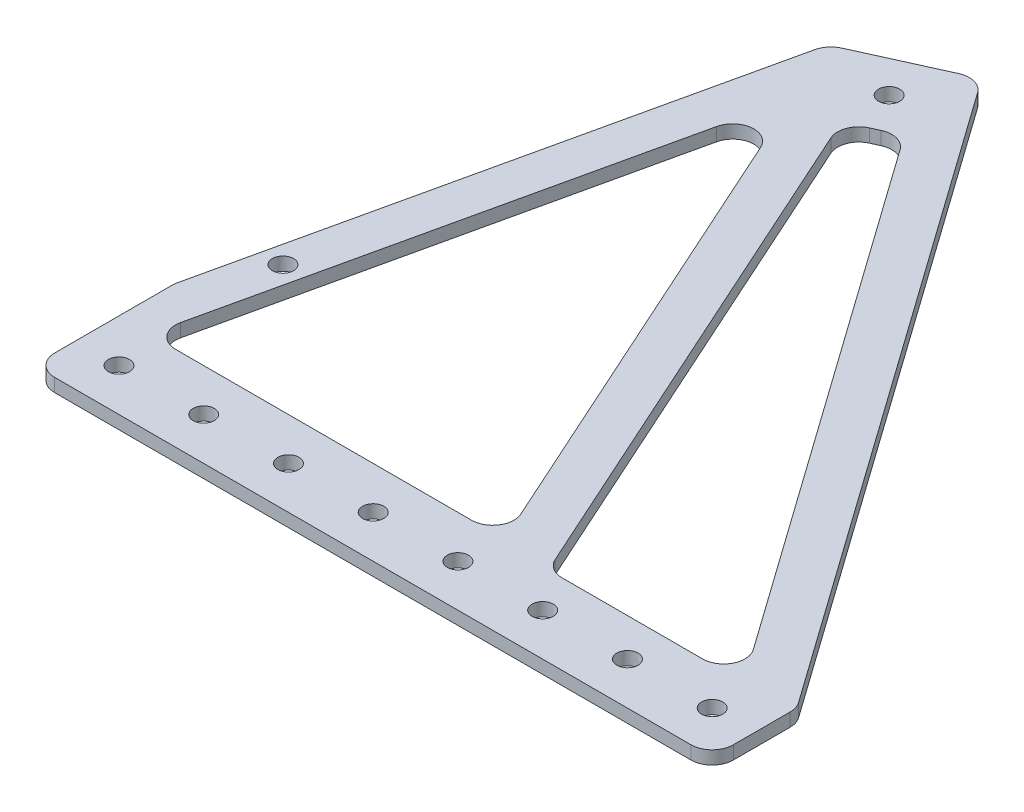
from build123d import *

# Parameters (mm, degrees)
SKETCH1_R           = 2
BOSS_EXTRUDE1_DEPTH = 2.5
FILLET2_R           = 4


with BuildPart() as part:
    # Sketch1 → Boss-Extrude1 (new body)
    with BuildSketch(Plane(origin=(0, 0, 0), x_dir=(1, 0, 0), z_dir=(0, 1, 0))):
        Polygon((-24, -8), (24, -8), (24, 8), (-61.475760907, 128.370940703), (-81.524239093, 119.312324779), (-104.126855641, 18.58956294), (-104.126855641, -8), (-86.093666761, -8), align=None)
        with Locations(Location((-16, 0, 0), (0, 0, 270))):
            Circle(SKETCH1_R, mode=Mode.SUBTRACT)
        with Locations(Location((16, 0, 0), (0, 0, 270))):
            Circle(SKETCH1_R, mode=Mode.SUBTRACT)
        with Locations(Location((0, 0, 0), (0, 0, 270))):
            Circle(SKETCH1_R, mode=Mode.SUBTRACT)
        with Locations(Location((-67.5, 116.913429511, 0), (0, 0, 270))):
            Circle(SKETCH1_R, mode=Mode.SUBTRACT)
        with Locations(Location((-32, 0, 0), (0, 0, 270))):
            Circle(SKETCH1_R, mode=Mode.SUBTRACT)
        with Locations(Location((-48, 0, 0), (0, 0, 270))):
            Circle(SKETCH1_R, mode=Mode.SUBTRACT)
        with Locations(Location((-64, 0, 0), (0, 0, 270))):
            Circle(SKETCH1_R, mode=Mode.SUBTRACT)
        with Locations(Location((-80, 0, 0), (0, 0, 270))):
            Circle(SKETCH1_R, mode=Mode.SUBTRACT)
        with Locations(Location((-96, 0, 0), (0, 0, 270))):
            Circle(SKETCH1_R, mode=Mode.SUBTRACT)
        with Locations(Location((-97.021679837, 31.983686003, 0), (0, 0, 270))):
            Circle(SKETCH1_R, mode=Mode.SUBTRACT)
        Polygon((-31.229369404, 8), (-76.046035256, 107.187994635), (-98.304243511, 8), align=None, mode=Mode.SUBTRACT)
        Polygon((-63.480229926, 109.950983508), (-59.488316608, 111.754672009), (14.80532848, 7.130906714), (-22.057960952, 7.130906714), (-67.661999872, 108.061511027), align=None, mode=Mode.SUBTRACT)
    extrude(amount=BOSS_EXTRUDE1_DEPTH)

    # Fillet2
    fillet2_edges = [part.edges().sort_by_distance(p)[0] for p in [
        (24, 1.25, -8),
        (24, 1.25, 8),
        (-104.126855641, 1.25, 8),
        (-104.126855641, 1.25, -18.58956294),
        (-81.524239093, 1.25, -119.312324779),
        (-61.475760907, 1.25, -128.370940703),
        (-67.661999872, 1.25, -108.061511027),
        (-22.057960952, 1.25, -7.130906714),
        (14.80532848, 1.25, -7.130906714),
        (-59.488316608, 1.25, -111.754672009),
        (-98.304243511, 1.25, -8),
        (-31.229369404, 1.25, -8),
        (-76.046035256, 1.25, -107.187994635),
    ]]
    fillet(fillet2_edges, radius=FILLET2_R)


solid = part.part
